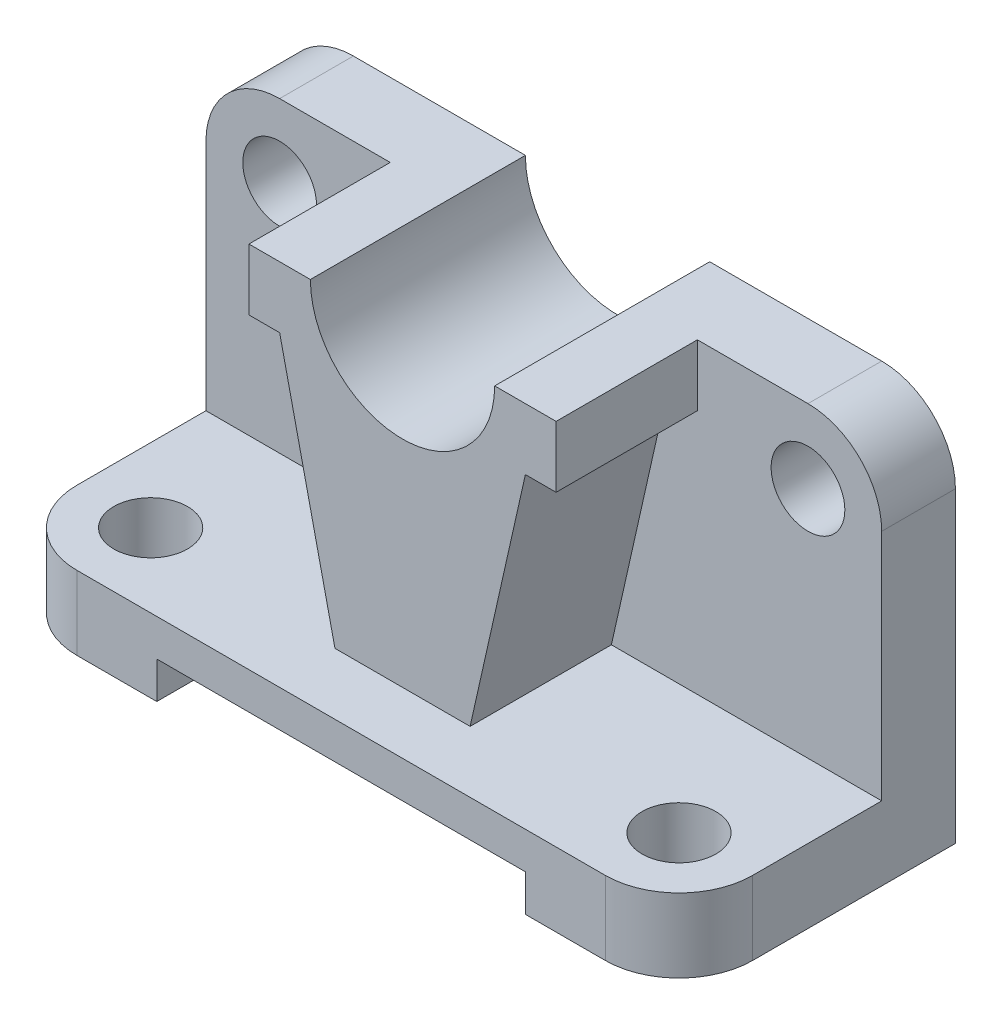
from build123d import *

# Parameters (mm, degrees)
BOSS_EXTRUDE2_DEPTH     = 45
BOSS_EXTRUDE3_DEPTH     = 35
SKETCH2_5_R             = 6
BOSS_EXTRUDE4_DEPTH     = 12
FILLET1_R               = 12
CUT_EXTRUDE1_DEPTH      = 87.890735985
CUT_EXTRUDE1_DEPTH_BACK = 87.890735985
SKETCH3_R               = 6


with BuildPart() as part:
    # Sketch2 → Boss-Extrude2 (new body)
    with BuildSketch(Plane.XY):
        Polygon((55, 0), (-55, 0), (-55, -12), (-30, -12), (-30, -6), (30, -6), (30, -12), (55, -12), align=None)
    extrude(amount=BOSS_EXTRUDE2_DEPTH)

    # Sketch2<4> → Boss-Extrude3 (add)
    with BuildSketch(Plane.XY):
        with BuildLine():
            Line((11, 0), (20, 40))
            Line((20, 40), (25, 40))
            Line((25, 40), (25, 50))
            Line((25, 50), (15, 50))
            ThreePointArc((15, 50), (0, 35), (-15, 50))
            Line((-15, 50), (-25, 50))
            Line((-25, 50), (-25, 40))
            Line((-25, 40), (-20, 40))
            Line((-20, 40), (-11, 0))
            Line((-11, 0), (11, 0))
        make_face()
    extrude(amount=BOSS_EXTRUDE3_DEPTH)

    # Sketch2<5> → Boss-Extrude4 (add)
    # profile 1 of 2: a face of its own
    with BuildSketch(Plane.XY):
        Polygon((11, 0), (55, 0), (55, 50), (25, 50), (25, 40), (20, 40), align=None)
        with Locations((43, 38)):
            Circle(SKETCH2_5_R, mode=Mode.SUBTRACT)
    # profile 2 of 2: a face of its own
    with BuildSketch(Plane.XY):
        Polygon((-55, 0), (-11, 0), (-20, 40), (-25, 40), (-25, 50), (-55, 50), align=None)
        with Locations((-43, 38)):
            Circle(SKETCH2_5_R, mode=Mode.SUBTRACT)
    extrude(amount=BOSS_EXTRUDE4_DEPTH)

    # Fillet1
    fillet1_edges = [part.edges().sort_by_distance(p)[0] for p in [
        (55, -6, 45),
        (-55, -6, 45),
        (-55, 50, 6),
        (55, 50, 6),
    ]]
    fillet(fillet1_edges, radius=FILLET1_R)

    # Sketch3 → Cut-Extrude1 (cut, two sides: drawn at the far end of the back side and taken through both)
    with BuildSketch(Plane(origin=(0, 0, 0), x_dir=(1, 0, 0), z_dir=(0, 1, 0)).offset(-CUT_EXTRUDE1_DEPTH_BACK)):
        with Locations((-43, -33)):
            Circle(SKETCH3_R)
        with Locations((43, -33)):
            Circle(SKETCH3_R)
    extrude(amount=CUT_EXTRUDE1_DEPTH + CUT_EXTRUDE1_DEPTH_BACK, mode=Mode.SUBTRACT)


solid = part.part
